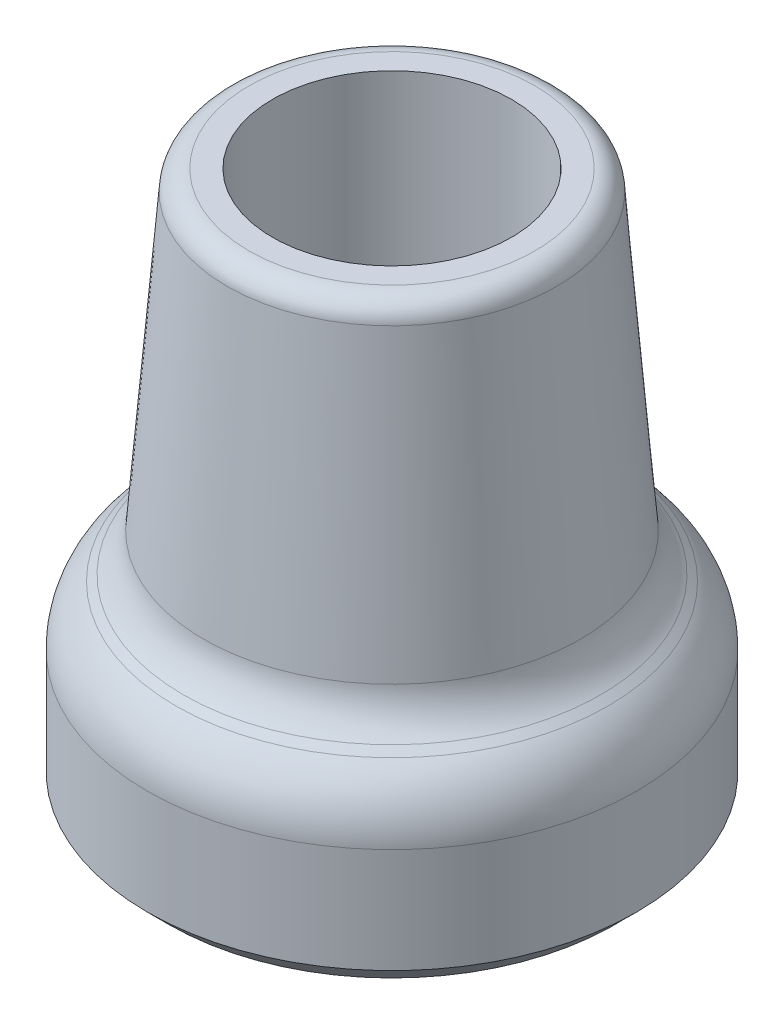
from build123d import *

# Parameters (mm, degrees)
FILLET_1_R     = 2
FILLET_2_R     = 5
FILLET_3_R     = 7
CHAMFER_1_SIZE = 2
FILLET_4_R     = 1


with BuildPart() as part:
    # Эскиз1 → Повернуть1 (revolve)
    with BuildSketch(Plane.XY, mode=Mode.PRIVATE) as revolve_1_sk:
        Polygon((0, 20), (-11, 20), (-11, 50), (-15, 50), (-17.5, 19), (-22.5, 15), (-22.5, 0), (0, 0), align=None)
    revolve(revolve_1_sk.sketch.rotate(Axis((0, 0, 0), (0, 1, 0)), 270), axis=Axis((0, 0, 0), (0, 1, 0)))

    # Скругление1
    fillet_1_edges = [part.edges().sort_by_distance(p)[0] for p in [
        (0, 50, 15),
    ]]
    fillet(fillet_1_edges, radius=FILLET_1_R)

    # Скругление2
    fillet_2_edges = [part.edges().sort_by_distance(p)[0] for p in [
        (0, 19, 17.5),
    ]]
    fillet(fillet_2_edges, radius=FILLET_2_R)

    # Скругление3
    fillet_3_edges = [part.edges().sort_by_distance(p)[0] for p in [
        (0, 15, 22.5),
    ]]
    fillet(fillet_3_edges, radius=FILLET_3_R)

    # Фаска1
    chamfer_1_edges = [part.edges().sort_by_distance(p)[0] for p in [
        (0, 0, 22.5),
    ]]
    chamfer(chamfer_1_edges, length=CHAMFER_1_SIZE)

    # Скругление4
    fillet_4_edges = [part.edges().sort_by_distance(p)[0] for p in [
        (0, 20, 11),
    ]]
    fillet(fillet_4_edges, radius=FILLET_4_R)


solid = part.part
